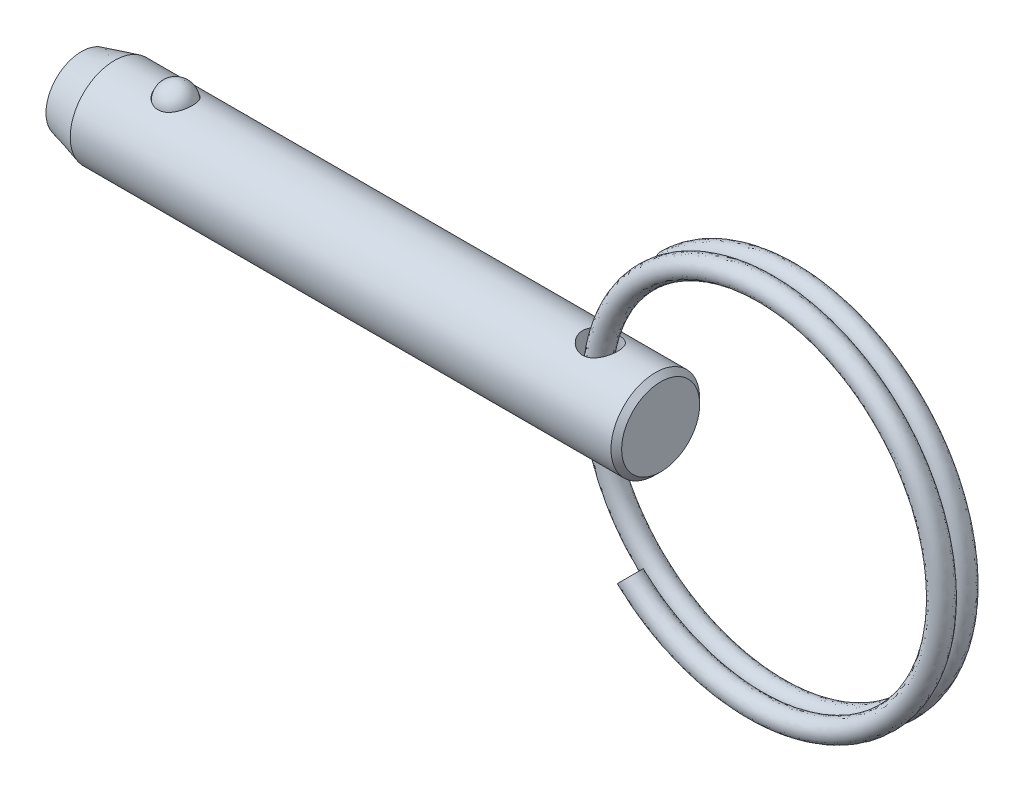
from build123d import *

# Parameters (mm, degrees)
SKETCH4_W          = 1.27
SKETCH4_H          = 6.35
SWEEP1_PITCH       = 1.5494
SWEEP1_HEIGHT      = 1.355725
SWEEP1_RADIUS      = 13.462
SKETCH6_R          = 0.762
SWEEP2_PITCH       = 1.5494
SWEEP2_HEIGHT      = 1.355725
SWEEP2_RADIUS      = 13.462
SWEEP2_START_ANGLE = -180
SKETCH6_2_R        = 0.762


with BuildPart() as part:
    # Sketch1 → Revolve1 (revolve)
    with BuildSketch(Plane.XY, mode=Mode.PRIVATE) as revolve1_sk:
        Polygon((20.7264, 2.794), (20.3454, 3.175), (-18.356547737, 3.175), (-20.7264, 2.54), (-20.7264, 0), (20.7264, 0), align=None)
    revolve(revolve1_sk.sketch.rotate(Axis((20.7264, 0, 0), (1, 0, 0)), 90), axis=Axis((20.7264, 0, 0), (1, 0, 0)))

    # Sketch2 → Cut-Revolve1 (revolve, cut)
    with BuildSketch(Plane.XY):
        with BuildLine():
            Line((-12.734582051, 2.8575), (-15.249182051, 2.8575))
            ThreePointArc((-15.249182051, 2.8575), (-13.991882051, 4.1148), (-12.734582051, 2.8575))
        make_face()
    revolve(axis=Axis((-12.734582051, 2.8575, 0), (1, 0, 0)), mode=Mode.SUBTRACT)

    # Sketch4 → Cut-Revolve2 (revolve, cut)
    with BuildSketch(Plane.XY, mode=Mode.PRIVATE) as cut_revolve2_sk:
        with Locations((17.0434, 0)):
            Rectangle(SKETCH4_W, SKETCH4_H)
    revolve(cut_revolve2_sk.sketch.rotate(Axis((16.4084, -3.175, 0), (0, 1, 0)), 90), axis=Axis((16.4084, -3.175, 0), (0, 1, 0)), mode=Mode.SUBTRACT)


with BuildPart() as body_2:
    # Sketch3 → Revolve2 (revolve)
    with BuildSketch(Plane.XY):
        with BuildLine():
            Line((-12.759982051, 2.8575), (-15.223782051, 2.8575))
            ThreePointArc((-15.223782051, 2.8575), (-13.991882051, 4.0894), (-12.759982051, 2.8575))
        make_face()
    revolve(axis=Axis((-12.759982051, 2.8575, 0), (1, 0, 0)))


with BuildPart() as body_3:
    # Sweep1: sweep along a helix
    with BuildLine() as sweep1_path:
        Helix(SWEEP1_PITCH, SWEEP1_HEIGHT, SWEEP1_RADIUS, center=(28.893425091, 0, 0), direction=(0, 0, -1), lefthand=True)
    # Sketch6 → Sweep1 (sweep)
    with BuildSketch(Plane(origin=(114.003847968, 0, 0), x_dir=(0, 0, -1), z_dir=(0, 1, 0))):
        with Locations((0, 97.810422877)):
            Circle(SKETCH6_R)
    sweep(path=sweep1_path.line, is_frenet=True)

    # Sweep2: sweep along a helix
    with BuildLine() as sweep2_path:
        add(Helix(SWEEP2_PITCH, SWEEP2_HEIGHT, SWEEP2_RADIUS, center=(28.893425091, 0, 0), direction=(0, 0, 1), lefthand=True, mode=Mode.PRIVATE).rotate(Axis((28.893425091, 0, 0), (0, 0, 1)), SWEEP2_START_ANGLE))
    # Sketch6<2> → Sweep2 (sweep)
    with BuildSketch(Plane(origin=(114.003847968, 0, 0), x_dir=(0, 0, -1), z_dir=(0, 1, 0))):
        with Locations((0, 97.810422877)):
            Circle(SKETCH6_2_R)
    sweep(path=sweep2_path.line, is_frenet=True)


solid = Compound([part.part, body_2.part, body_3.part])
